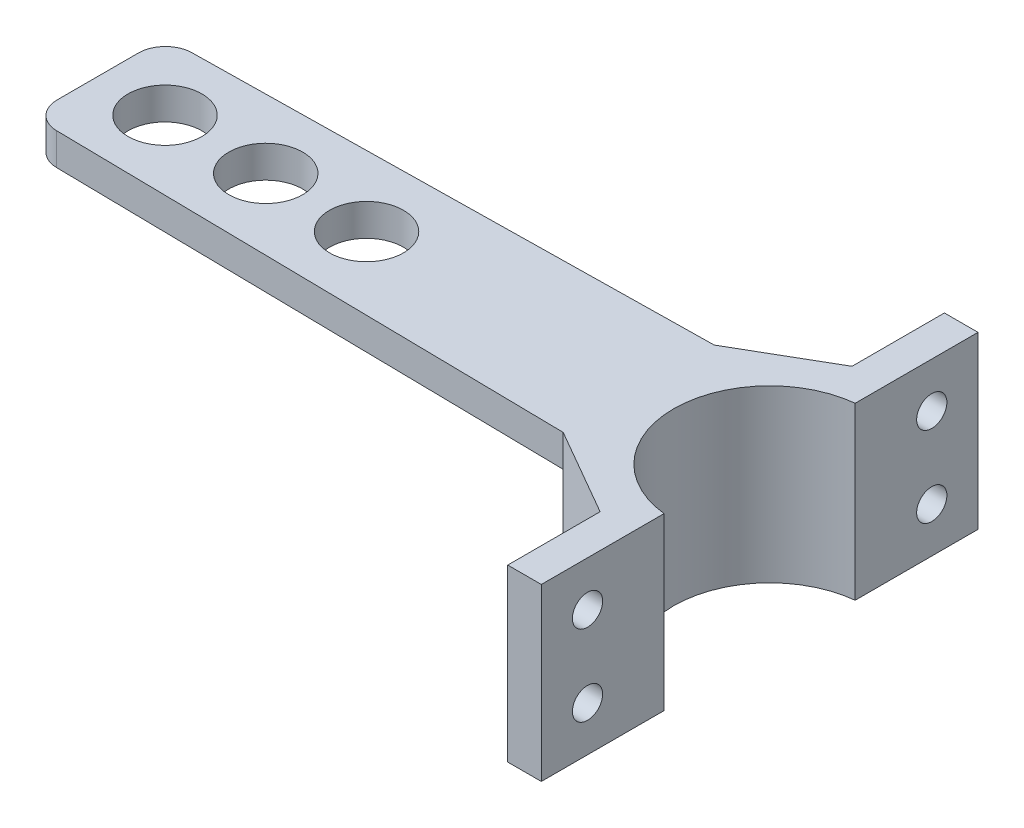
from build123d import *

# Parameters (mm, degrees)
BOSS_EXTRUDE1_DEPTH = 25.4
SKETCH2_R           = 2.25
CUT_EXTRUDE1_DEPTH  = 44.249277532
SKETCH3_R           = 5.5
BOSS_EXTRUDE2_DEPTH = 4.7625
FILLET1_R           = 4


with BuildPart() as part:
    # Sketch1 → Boss-Extrude1 (new body)
    with BuildSketch(Plane(origin=(0, 0, 0), x_dir=(1, 0, 0), z_dir=(0, 1, 0))):
        Polygon((-6.5, 18.750739811), (-1.5, 21.642901866), (-1.5, 32.503507515), (-6.5, 32.503507515), align=None)
        with BuildLine():
            Line((-1.5, -21.625070485), (-1.5, -14.221111068))
            ThreePointArc((-1.5, -14.221111068), (-14.3, 0), (-1.5, 14.221111068))
            Line((-1.5, 14.221111068), (-1.5, 21.642901866))
            Line((-1.5, 21.642901866), (-6.5, 18.750739811))
            Line((-6.5, 18.750739811), (-19.494691465, 11.234189098))
            Line((-19.494691465, 11.234189098), (-19.476438882, -11.265803499))
            Line((-19.476438882, -11.265803499), (-6.5, -18.743724782))
            Line((-6.5, -18.743724782), (-1.5, -21.625070485))
        make_face()
        Polygon((-1.5, -32.496492485), (-1.5, -21.625070485), (-6.5, -18.743724782), (-6.5, -32.496492485), align=None)
    extrude(amount=BOSS_EXTRUDE1_DEPTH)

    # Sketch2 → Cut-Extrude1 (cut, through all)
    with BuildSketch(Plane.ZY.offset(6.5)):
        with Locations((25.620108634, 18.7)):
            Circle(SKETCH2_R)
        with Locations((25.620108634, 6.7)):
            Circle(SKETCH2_R)
    cut_extrude1 = extrude(amount=-CUT_EXTRUDE1_DEPTH, mode=Mode.SUBTRACT)

    # Mirror1: Cut-Extrude1 across plane
    add(cut_extrude1.mirror(Plane.XY), mode=Mode.SUBTRACT)

    # Sketch3 → Boss-Extrude2 (add)
    with BuildSketch(Plane(origin=(0, 25.4, 0), x_dir=(1, 0, 0), z_dir=(0, 1, 0))):
        Polygon((-100, 9.984192799), (-100, -10.015807201), (-19.476438882, -11.265803499), (-19.494691465, 11.234189098), align=None)
        with Locations(Location((-60, -0.015807201, 0), (0, 0, 270))):
            Circle(SKETCH3_R, mode=Mode.SUBTRACT)
        with Locations(Location((-75, -0.015807201, 0), (0, 0, 270))):
            Circle(SKETCH3_R, mode=Mode.SUBTRACT)
        with Locations(Location((-90, -0.015807201, 0), (0, 0, 270))):
            Circle(SKETCH3_R, mode=Mode.SUBTRACT)
    extrude(amount=-BOSS_EXTRUDE2_DEPTH)

    # Fillet1
    fillet1_edges = [part.edges().sort_by_distance(p)[0] for p in [
        (-100, 23.01875, 10.015807201),
        (-100, 23.01875, -9.984192799),
    ]]
    fillet(fillet1_edges, radius=FILLET1_R)


solid = part.part
